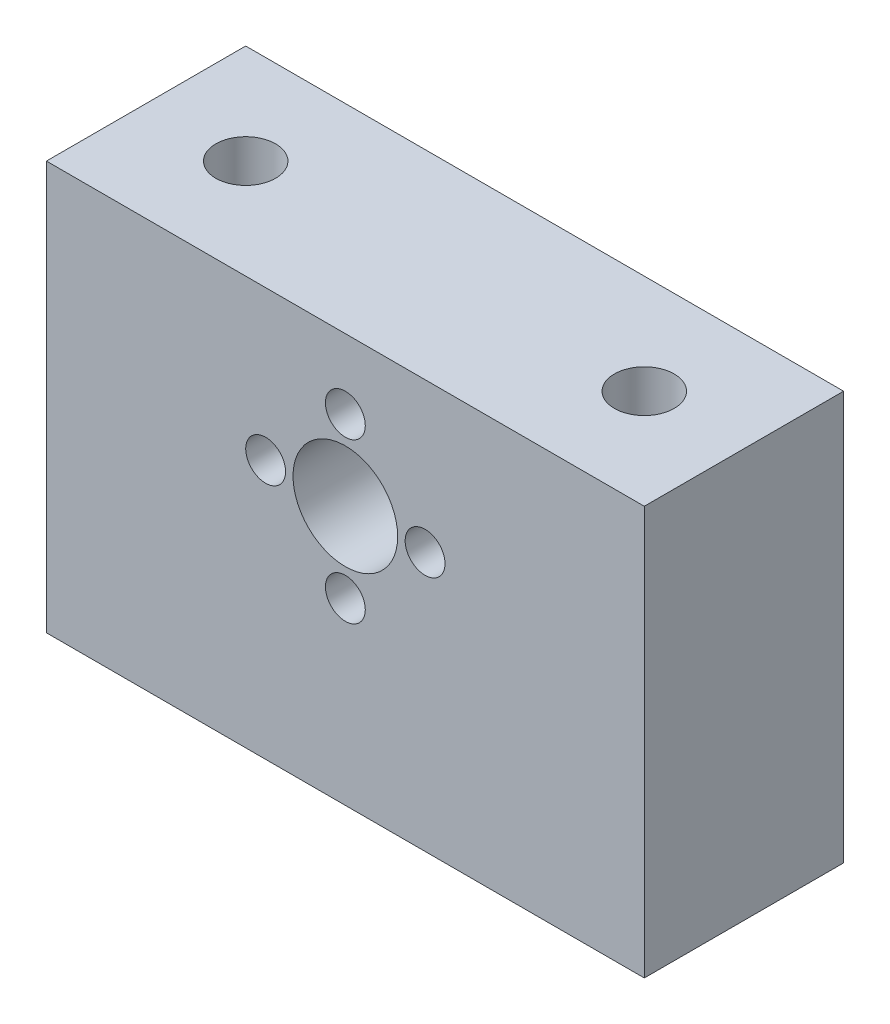
from build123d import *

# Parameters (mm, degrees)
SKETCH1_W           = 60
SKETCH1_H           = 41
SKETCH1_R           = 5.25
SKETCH1_R_2         = 2
BOSS_EXTRUDE1_DEPTH = 20
SKETCH2_R           = 3
CUT_EXTRUDE1_DEPTH  = 55.598534779


with BuildPart() as part:
    # Sketch1 → Boss-Extrude1 (new body)
    with BuildSketch(Plane.XY):
        with Locations((0, -5.5)):
            Rectangle(SKETCH1_W, SKETCH1_H)
        Circle(SKETCH1_R, mode=Mode.SUBTRACT)
        with Locations((0, 8)):
            Circle(SKETCH1_R_2, mode=Mode.SUBTRACT)
        with Locations((8, 0)):
            Circle(SKETCH1_R_2, mode=Mode.SUBTRACT)
        with Locations((0, -8)):
            Circle(SKETCH1_R_2, mode=Mode.SUBTRACT)
        with Locations((-8, 0)):
            Circle(SKETCH1_R_2, mode=Mode.SUBTRACT)
    extrude(amount=BOSS_EXTRUDE1_DEPTH)

    # Sketch2 → Cut-Extrude1 (cut, through all)
    with BuildSketch(Plane(origin=(0, 15, 0), x_dir=(1, 0, 0), z_dir=(0, 1, 0))):
        with Locations(Location((-20, -10, 0), (0, 0, 270))):
            Circle(SKETCH2_R)
        with Locations(Location((20, -10, 0), (0, 0, 90))):
            Circle(SKETCH2_R)
    extrude(amount=-CUT_EXTRUDE1_DEPTH, mode=Mode.SUBTRACT)


solid = part.part
